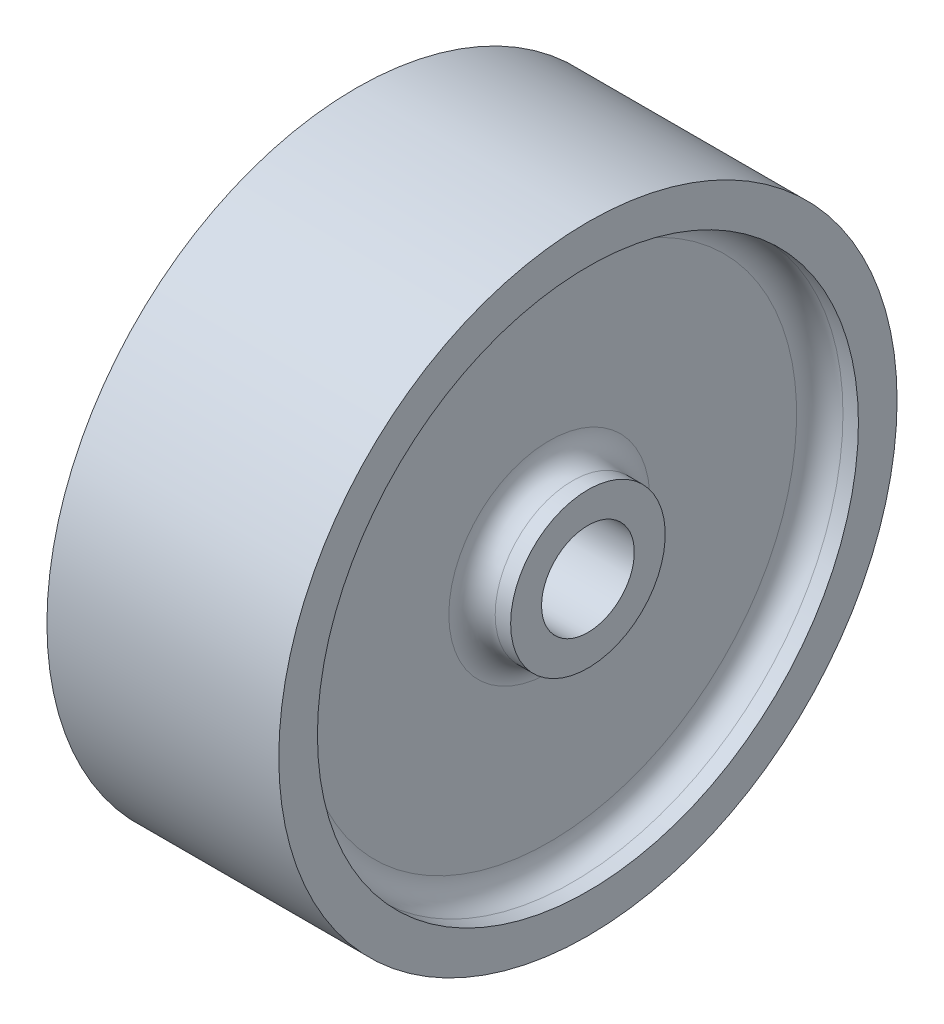
from build123d import *


with BuildPart() as part:
    # Sketch2 → Revolve1 (revolve)
    with BuildSketch(Plane.XY, mode=Mode.PRIVATE) as revolve1_sk:
        with BuildLine():
            Line((-15, 40), (15, 40))
            Line((15, 40), (15, 35))
            Line((15, 35), (13, 35))
            ThreePointArc((13, 35), (10.878679656, 34.121320344), (10, 32))
            Line((10, 32), (10, 13))
            ThreePointArc((10, 13), (10.878679656, 10.878679656), (13, 10))
            Line((13, 10), (15, 10))
            Line((15, 10), (15, 6))
            Line((15, 6), (-15, 6))
            Line((-15, 6), (-15, 10))
            Line((-15, 10), (-13, 10))
            ThreePointArc((-13, 10), (-10.878679656, 10.878679656), (-10, 13))
            Line((-10, 13), (-10, 32))
            ThreePointArc((-10, 32), (-10.878679656, 34.121320344), (-13, 35))
            Line((-13, 35), (-15, 35))
            Line((-15, 35), (-15, 40))
        make_face()
    revolve(revolve1_sk.sketch.rotate(Axis((-15, 0, 0), (1, 0, 0)), 90), axis=Axis((-15, 0, 0), (1, 0, 0)))


solid = part.part
